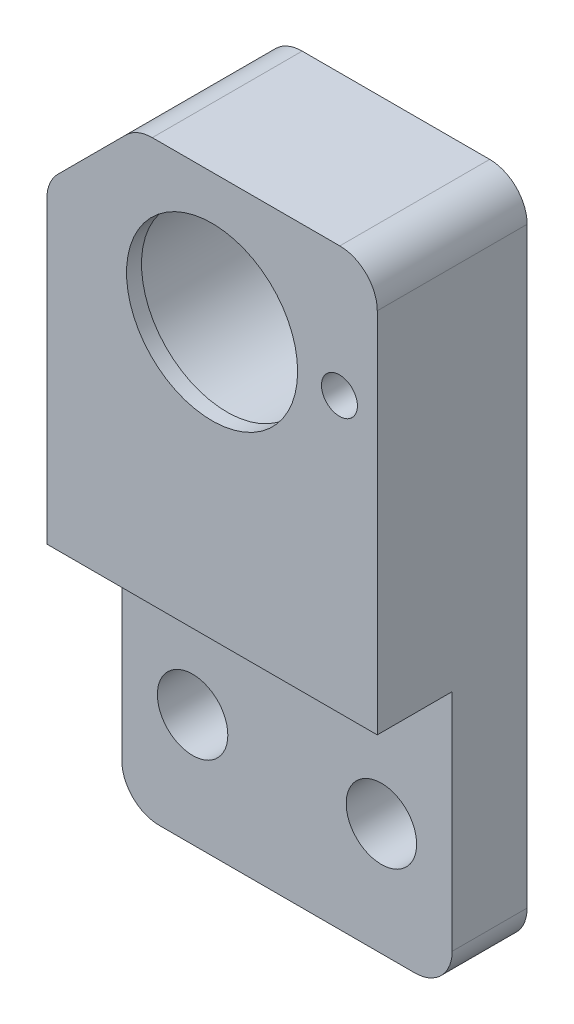
from build123d import *

# Parameters (mm, degrees)
SKETCH1_R           = 2.9845
SKETCH1_R_2         = 7.9502
SKETCH1_R_3         = 1.524
SKETCH1_R_4         = 7.250000001
BOSS_EXTRUDE1_DEPTH = 12.7
SKETCH1_3_R         = 7.9502
SKETCH1_3_R_2       = 7.250000001
CUT_EXTRUDE1_DEPTH  = 11.43
CUT_EXTRUDE2_START  = 6.35
SKETCH1_4_R         = 2.9845
CUT_EXTRUDE2_DEPTH  = 6.35


with BuildPart() as part:
    # Sketch1 → Boss-Extrude1 (new body)
    # profile 1 of 3: a face of its own
    with BuildSketch(Plane.XY):
        with BuildLine():
            ThreePointArc((211.319871652, 66.845549451), (212.249807622, 64.60048542), (214.494871652, 63.670549451))
            Line((214.494871652, 63.670549451), (236.144871651, 63.670549451))
            ThreePointArc((236.144871651, 63.670549451), (238.389935682, 64.60048542), (239.319871651, 66.845549451))
            Line((239.319871651, 66.845549451), (239.319871651, 85.900629451))
            Line((239.319871651, 85.900629451), (211.319871652, 85.900629451))
            Line((211.319871652, 85.900629451), (211.319871652, 66.845549451))
        make_face()
        with Locations((217.319871651, 73.200629451)):
            Circle(SKETCH1_R, mode=Mode.SUBTRACT)
        with Locations((233.319871652, 73.200629451)):
            Circle(SKETCH1_R, mode=Mode.SUBTRACT)
    # profile 2 of 3: a face of its own
    with BuildSketch(Plane.XY):
        with BuildLine():
            Line((211.319871652, 111.26550139), (211.319871652, 85.900629451))
            Line((211.319871652, 85.900629451), (239.319871651, 85.900629451))
            Line((239.319871651, 85.900629451), (239.319871651, 117.025629451))
            ThreePointArc((239.319871651, 117.025629451), (238.389935682, 119.270693481), (236.144871651, 120.200629451))
            Line((236.144871651, 120.200629451), (220.254999713, 120.200629451))
            ThreePointArc((220.254999713, 120.200629451), (219.039979814, 119.958946966), (218.009935681, 119.27069348))
            Line((218.009935681, 119.27069348), (212.24980762, 113.510565419))
            ThreePointArc((212.24980762, 113.510565419), (211.561554136, 112.480521287), (211.319871652, 111.26550139))
        make_face()
        with Locations((225.31987165, 109.200629449)):
            Circle(SKETCH1_R_2, mode=Mode.SUBTRACT)
        with Locations((236.11487165, 109.200629449)):
            Circle(SKETCH1_R_3, mode=Mode.SUBTRACT)
    # profile 3 of 3: a face of its own
    with BuildSketch(Plane.XY):
        with Locations((225.31987165, 109.200629449)):
            Circle(SKETCH1_R_2)
        with Locations((225.31987165, 109.200629449)):
            Circle(SKETCH1_R_4, mode=Mode.SUBTRACT)
    extrude(amount=BOSS_EXTRUDE1_DEPTH)

    # Sketch1<3> → Cut-Extrude1 (cut)
    with BuildSketch(Plane.XY):
        with Locations((225.31987165, 109.200629449)):
            Circle(SKETCH1_3_R)
        with Locations((225.31987165, 109.200629449)):
            Circle(SKETCH1_3_R_2, mode=Mode.SUBTRACT)
    extrude(amount=CUT_EXTRUDE1_DEPTH, mode=Mode.SUBTRACT)

    # Sketch1<4> → Cut-Extrude2 (cut)
    with BuildSketch(Plane.XY.offset(CUT_EXTRUDE2_START)):
        with BuildLine():
            ThreePointArc((211.319871652, 66.845549451), (212.249807622, 64.60048542), (214.494871652, 63.670549451))
            Line((214.494871652, 63.670549451), (236.144871651, 63.670549451))
            ThreePointArc((236.144871651, 63.670549451), (238.389935682, 64.60048542), (239.319871651, 66.845549451))
            Line((239.319871651, 66.845549451), (239.319871651, 85.900629451))
            Line((239.319871651, 85.900629451), (211.319871652, 85.900629451))
            Line((211.319871652, 85.900629451), (211.319871652, 66.845549451))
        make_face()
        with Locations((217.319871651, 73.200629451)):
            Circle(SKETCH1_4_R, mode=Mode.SUBTRACT)
        with Locations((233.319871652, 73.200629451)):
            Circle(SKETCH1_4_R, mode=Mode.SUBTRACT)
    extrude(amount=CUT_EXTRUDE2_DEPTH, mode=Mode.SUBTRACT)


solid = part.part
